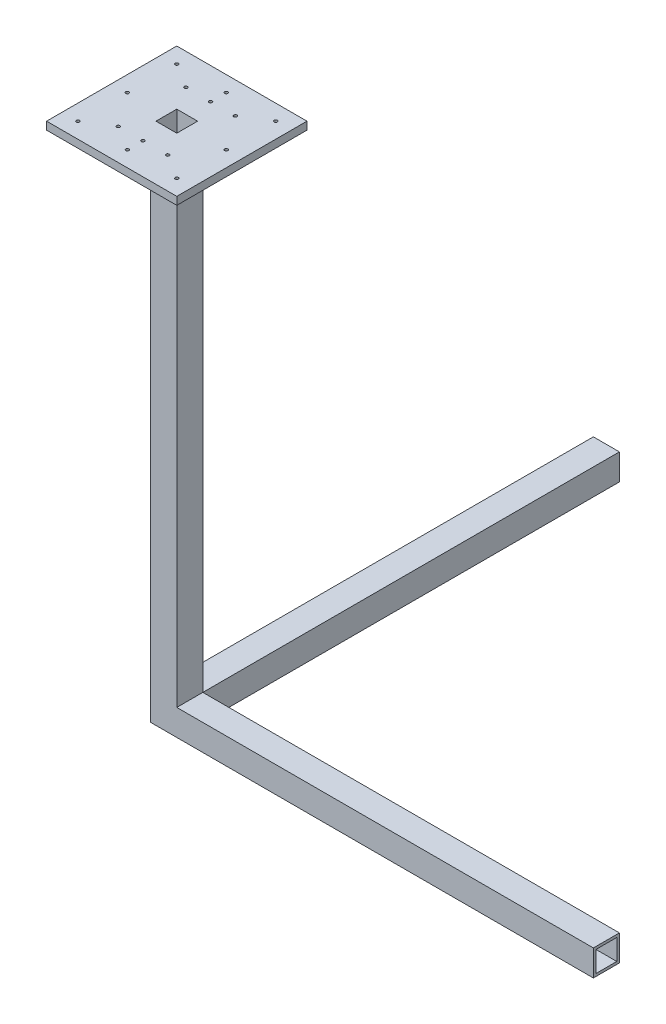
from build123d import *

# Parameters (mm, degrees)
SKETCH1_W             = 25
SKETCH1_H             = 25
SKETCH1_W_2           = 20
SKETCH1_H_2           = 20
BOSS_EXTRUDE1_DEPTH   = 500
SKETCH2_W             = 125
SKETCH2_H             = 125
SKETCH2_W_2           = 25
SKETCH2_H_2           = 25
BOSS_EXTRUDE2_DEPTH   = 7.5
F_3_0MM_DOWEL_HOLE1_D = 3
SKETCH7_W             = 25
SKETCH7_H             = 25
SKETCH7_W_2           = 20
SKETCH7_H_2           = 20
BOSS_EXTRUDE3_DEPTH   = 400
SKETCH8_W             = 25
SKETCH8_H             = 25
SKETCH8_W_2           = 20
SKETCH8_H_2           = 20
BOSS_EXTRUDE4_DEPTH   = 400


with BuildPart() as part:
    # Sketch1 → Boss-Extrude1 (new body)
    with BuildSketch(Plane(origin=(0, 0, 0), x_dir=(1, 0, 0), z_dir=(0, 1, 0))):
        with Locations((12.5, 12.5)):
            Rectangle(SKETCH1_W, SKETCH1_H)
        with Locations((12.5, 12.5)):
            Rectangle(SKETCH1_W_2, SKETCH1_H_2, mode=Mode.SUBTRACT)
    extrude(amount=BOSS_EXTRUDE1_DEPTH)

    # Sketch2 → Boss-Extrude2 (add)
    with BuildSketch(Plane(origin=(0, 500, 0), x_dir=(1, 0, 0), z_dir=(0, 1, 0))):
        with Locations((12.5, 12.5)):
            Rectangle(SKETCH2_W, SKETCH2_H)
        with Locations((12.5, 12.5)):
            Rectangle(SKETCH2_W_2, SKETCH2_H_2, mode=Mode.SUBTRACT)
    extrude(amount=-BOSS_EXTRUDE2_DEPTH)

    # Ø3.0mm Dowel Hole1 (through all)
    with Locations(Plane(origin=(0, 500, 0), x_dir=(1, 0, 0), z_dir=(0, 1, 0))):
        with Locations((-35, 60), (12.5, 60), (60, 60), (60, 12.5), (60, -35), (12.5, -35), (-35, -35), (-35, 12.5), (12.5, 45), (12.5, -20), (-11.25, 45), (36.25, 45), (-11.25, -20), (36.25, -20)):
            Hole(F_3_0MM_DOWEL_HOLE1_D / 2)

    # Sketch7 → Boss-Extrude3 (add)
    with BuildSketch(Plane(origin=(0, 0, -25), x_dir=(-1, 0, 0), z_dir=(0, 0, -1))):
        with Locations((-12.5, 12.5)):
            Rectangle(SKETCH7_W, SKETCH7_H)
        with Locations((-12.5, 12.5)):
            Rectangle(SKETCH7_W_2, SKETCH7_H_2, mode=Mode.SUBTRACT)
    extrude(amount=BOSS_EXTRUDE3_DEPTH)

    # Sketch8 → Boss-Extrude4 (add)
    with BuildSketch(Plane(origin=(25, 0, 0), x_dir=(0, 0, -1), z_dir=(1, 0, 0))):
        with Locations((12.5, 12.5)):
            Rectangle(SKETCH8_W, SKETCH8_H)
        with Locations((12.5, 12.5)):
            Rectangle(SKETCH8_W_2, SKETCH8_H_2, mode=Mode.SUBTRACT)
    extrude(amount=BOSS_EXTRUDE4_DEPTH)


solid = part.part
